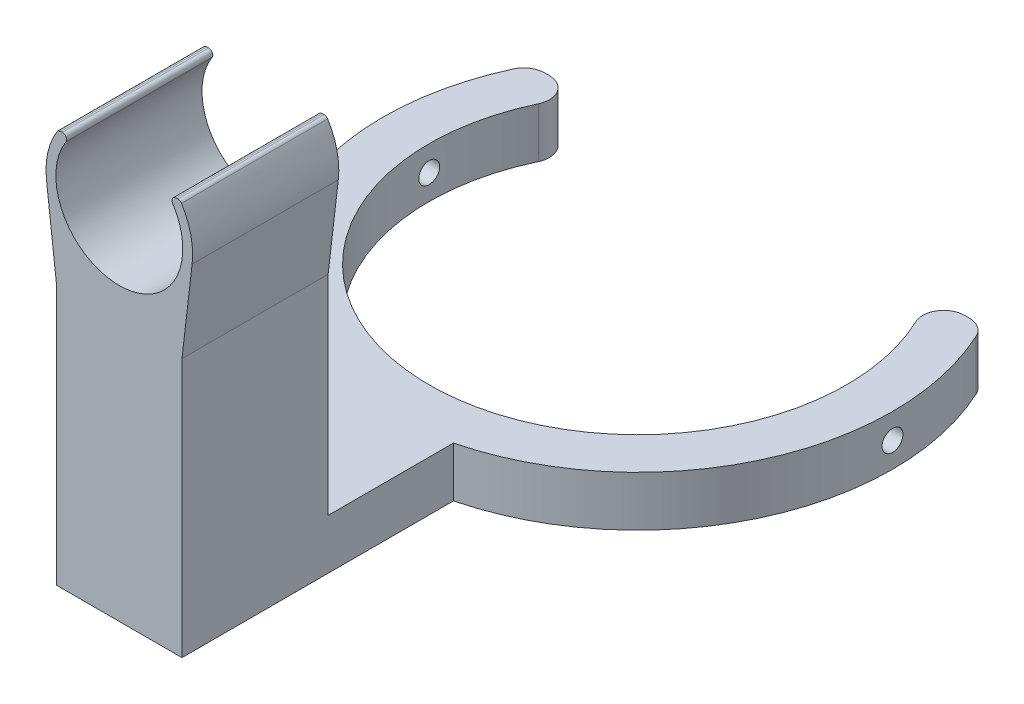
from build123d import *

# Parameters (mm, degrees)
BOSS_EXTRUDE1_DEPTH = 12
SKETCH2_R           = 2.5
CUT_EXTRUDE1_DEPTH  = 500
SKETCH4_W           = 35
SKETCH4_H           = 50
BOSS_EXTRUDE2_DEPTH = 30
BOSS_EXTRUDE3_DEPTH = 35
FILLET1_R           = 5
FILLET2_R           = 1
FILLET_1_R          = 1


with BuildPart() as part:
    # Sketch1 → Boss-Extrude1 (new body)
    with BuildSketch(Plane(origin=(0, 0, 0), x_dir=(1, 0, 0), z_dir=(0, 1, 0))):
        with BuildLine():
            Line((-41.057019736, 28.536312488), (-53.951781887, 28.536312488))
            ThreePointArc((-53.951781887, 28.536312488), (-55.779259556, -24.774787639), (-15, -59.16177735))
            Line((-15, -59.16177735), (15, -59.16177735))
            ThreePointArc((15, -59.16177735), (55.779259556, -24.774787639), (53.951781887, 28.536312488))
            Line((53.951781887, 28.536312488), (41.057019736, 28.536312488))
            ThreePointArc((41.057019736, 28.536312488), (0, -50), (-41.057019736, 28.536312488))
        make_face()
        with BuildLine():
            ThreePointArc((15, -59.16177735), (0, -61.033727554), (-15, -59.16177735))
            Line((-15, -59.16177735), (-15, -124.16177735))
            Line((-15, -124.16177735), (15, -124.16177735))
            Line((15, -124.16177735), (15, -59.16177735))
        make_face()
        with BuildLine():
            Line((15, -59.16177735), (-15, -59.16177735))
            ThreePointArc((-15, -59.16177735), (0, -61.033727554), (15, -59.16177735))
        make_face()
    extrude(amount=BOSS_EXTRUDE1_DEPTH)

    # Sketch2 → Cut-Extrude1 (cut, symmetric)
    with BuildSketch(Plane(origin=(15, 0, 0), x_dir=(0, 0, -1), z_dir=(1, 0, 0))):
        with Locations((0, 6)):
            Circle(SKETCH2_R)
    extrude(amount=CUT_EXTRUDE1_DEPTH, both=True, mode=Mode.SUBTRACT)

    # Sketch4 → Boss-Extrude2 (add)
    with BuildSketch(Plane.ZY.offset(15)):
        with Locations((106.66177735, 37)):
            Rectangle(SKETCH4_W, SKETCH4_H)
    extrude(amount=-BOSS_EXTRUDE2_DEPTH)

    # Sketch5 → Boss-Extrude3 (add)
    with BuildSketch(Plane.XY.offset(124.16177735)):
        with BuildLine():
            Line((-11.643875535, 94.635635732), (-14.586391276, 94.635635732))
            ThreePointArc((-14.586391276, 94.635635732), (-17.06618452, 88.984526001), (-17.437258677, 82.824435117))
            Line((-17.437258677, 82.824435117), (-15, 62))
            Line((-15, 62), (15, 62))
            Line((15, 62), (17.437258677, 82.824435117))
            ThreePointArc((17.437258677, 82.824435117), (17.06618452, 88.984526001), (14.586391276, 94.635635732))
            Line((14.586391276, 94.635635732), (11.643875535, 94.635635732))
            ThreePointArc((11.643875535, 94.635635732), (0, 69.665264065), (-11.643875535, 94.635635732))
        make_face()
    extrude(amount=-BOSS_EXTRUDE3_DEPTH)

    # Fillet1
    fillet1_edges = [part.edges().sort_by_distance(p)[0] for p in [
        (-53.951781887, 6, -28.536312488),
        (-41.057019736, 6, -28.536312488),
        (41.057019736, 6, -28.536312488),
        (53.951781887, 6, -28.536312488),
    ]]
    fillet(fillet1_edges, radius=FILLET1_R)

    # Fillet2
    fillet2_edges = [part.edges().sort_by_distance(p)[0] for p in [
        (11.643875535, 94.635635732, 106.66177735),
        (-11.643875535, 94.635635732, 106.66177735),
    ]]
    fillet(fillet2_edges, radius=FILLET2_R)

    # 圆角1
    fillet_1_edges = [part.edges().sort_by_distance(p)[0] for p in [
        (14.586391276, 94.635635732, 106.66177735),
        (-14.586391276, 94.635635732, 106.66177735),
    ]]
    fillet(fillet_1_edges, radius=FILLET_1_R)


solid = part.part
